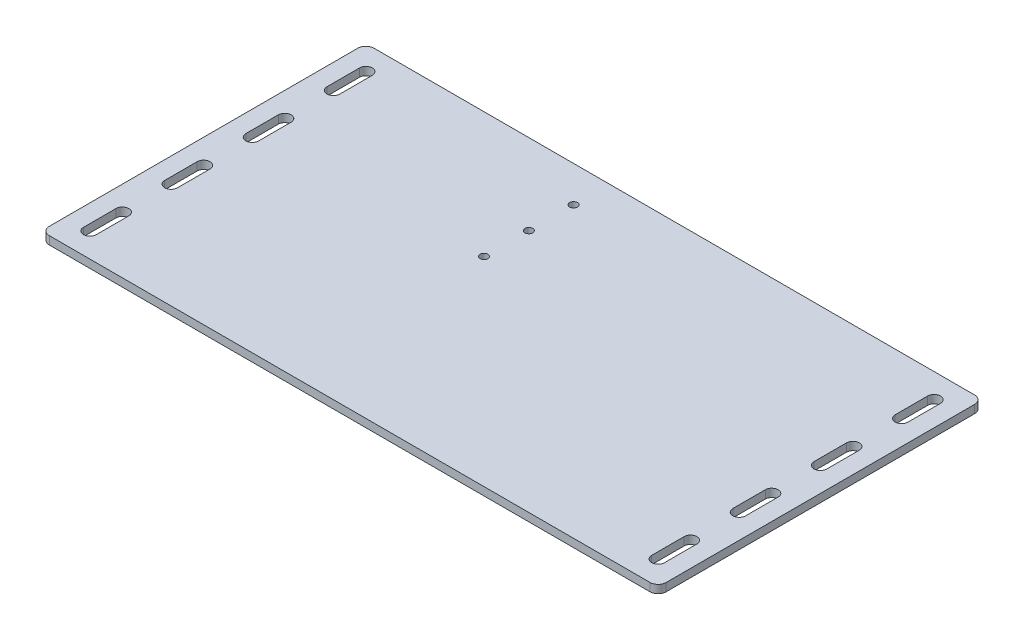
from build123d import *

# Parameters (mm, degrees)
SKETCH1_W           = 482.6
SKETCH1_H           = 254
BOSS_EXTRUDE1_DEPTH = 3.175
FILLET1_R           = 6.35
CUT_EXTRUDE1_REACH  = 274.754
SKETCH3_R           = 3.05
CUT_EXTRUDE2_DEPTH  = 273.754491255


with BuildPart() as part:
    # Sketch1 → Boss-Extrude1 (new, symmetric)
    with BuildSketch(Plane(origin=(0, 0, 0), x_dir=(1, 0, 0), z_dir=(0, 1, 0))):
        Rectangle(SKETCH1_W, SKETCH1_H)
    extrude(amount=BOSS_EXTRUDE1_DEPTH, both=True)

    # Fillet1
    fillet1_edges = [part.edges().sort_by_distance(p)[0] for p in [
        (241.3, 0, 127),
        (-241.3, 0, 127),
        (-241.3, 0, -127),
        (241.3, 0, -127),
    ]]
    fillet(fillet1_edges, radius=FILLET1_R)

    # Sketch2 → Cut-Extrude1 (cut, up to next)
    with BuildSketch(Plane(origin=(0, 3.175, 0), x_dir=(1, 0, 0), z_dir=(0, 1, 0)), mode=Mode.PRIVATE) as cut_extrude1_sk1:
        with BuildLine():
            Line((227.25, -82.55), (227.25, -107.95))
            ThreePointArc((227.25, -107.95), (222.25, -112.95), (217.25, -107.95))
            Line((217.25, -107.95), (217.25, -82.55))
            ThreePointArc((217.25, -82.55), (222.25, -77.55), (227.25, -82.55))
        make_face()
    cut_extrude1_tool1 = extrude(cut_extrude1_sk1.sketch, amount=-CUT_EXTRUDE1_REACH, mode=Mode.PRIVATE) & part.part
    # Sketch2 → Cut-Extrude1 (cut, up to next)
    with BuildSketch(Plane(origin=(0, 3.175, 0), x_dir=(1, 0, 0), z_dir=(0, 1, 0)), mode=Mode.PRIVATE) as cut_extrude1_sk2:
        with BuildLine():
            Line((227.25, -44.45), (227.25, -19.05))
            ThreePointArc((227.25, -19.05), (222.25, -14.05), (217.25, -19.05))
            Line((217.25, -19.05), (217.25, -44.45))
            ThreePointArc((217.25, -44.45), (222.25, -49.45), (227.25, -44.45))
        make_face()
    cut_extrude1_tool2 = extrude(cut_extrude1_sk2.sketch, amount=-CUT_EXTRUDE1_REACH, mode=Mode.PRIVATE) & part.part
    # Sketch2 → Cut-Extrude1 (cut, up to next)
    with BuildSketch(Plane(origin=(0, 3.175, 0), x_dir=(1, 0, 0), z_dir=(0, 1, 0)), mode=Mode.PRIVATE) as cut_extrude1_sk3:
        with BuildLine():
            Line((227.25, 44.45), (227.25, 19.05))
            ThreePointArc((227.25, 19.05), (222.25, 14.05), (217.25, 19.05))
            Line((217.25, 19.05), (217.25, 44.45))
            ThreePointArc((217.25, 44.45), (222.25, 49.45), (227.25, 44.45))
        make_face()
    cut_extrude1_tool3 = extrude(cut_extrude1_sk3.sketch, amount=-CUT_EXTRUDE1_REACH, mode=Mode.PRIVATE) & part.part
    # Sketch2 → Cut-Extrude1 (cut, up to next)
    with BuildSketch(Plane(origin=(0, 3.175, 0), x_dir=(1, 0, 0), z_dir=(0, 1, 0)), mode=Mode.PRIVATE) as cut_extrude1_sk4:
        with BuildLine():
            Line((227.25, 82.55), (227.25, 107.95))
            ThreePointArc((227.25, 107.95), (222.25, 112.95), (217.25, 107.95))
            Line((217.25, 107.95), (217.25, 82.55))
            ThreePointArc((217.25, 82.55), (222.25, 77.55), (227.25, 82.55))
        make_face()
    cut_extrude1_tool4 = extrude(cut_extrude1_sk4.sketch, amount=-CUT_EXTRUDE1_REACH, mode=Mode.PRIVATE) & part.part
    # Sketch2 → Cut-Extrude1 (cut, up to next)
    with BuildSketch(Plane(origin=(0, 3.175, 0), x_dir=(1, 0, 0), z_dir=(0, 1, 0)), mode=Mode.PRIVATE) as cut_extrude1_sk5:
        with BuildLine():
            Line((-227.25, 82.55), (-227.25, 107.95))
            ThreePointArc((-227.25, 107.95), (-222.25, 112.95), (-217.25, 107.95))
            Line((-217.25, 107.95), (-217.25, 82.55))
            ThreePointArc((-217.25, 82.55), (-222.25, 77.55), (-227.25, 82.55))
        make_face()
    cut_extrude1_tool5 = extrude(cut_extrude1_sk5.sketch, amount=-CUT_EXTRUDE1_REACH, mode=Mode.PRIVATE) & part.part
    # Sketch2 → Cut-Extrude1 (cut, up to next)
    with BuildSketch(Plane(origin=(0, 3.175, 0), x_dir=(1, 0, 0), z_dir=(0, 1, 0)), mode=Mode.PRIVATE) as cut_extrude1_sk6:
        with BuildLine():
            Line((-227.25, 44.45), (-227.25, 19.05))
            ThreePointArc((-227.25, 19.05), (-222.25, 14.05), (-217.25, 19.05))
            Line((-217.25, 19.05), (-217.25, 44.45))
            ThreePointArc((-217.25, 44.45), (-222.25, 49.45), (-227.25, 44.45))
        make_face()
    cut_extrude1_tool6 = extrude(cut_extrude1_sk6.sketch, amount=-CUT_EXTRUDE1_REACH, mode=Mode.PRIVATE) & part.part
    # Sketch2 → Cut-Extrude1 (cut, up to next)
    with BuildSketch(Plane(origin=(0, 3.175, 0), x_dir=(1, 0, 0), z_dir=(0, 1, 0)), mode=Mode.PRIVATE) as cut_extrude1_sk7:
        with BuildLine():
            Line((-227.25, -44.45), (-227.25, -19.05))
            ThreePointArc((-227.25, -19.05), (-222.25, -14.05), (-217.25, -19.05))
            Line((-217.25, -19.05), (-217.25, -44.45))
            ThreePointArc((-217.25, -44.45), (-222.25, -49.45), (-227.25, -44.45))
        make_face()
    cut_extrude1_tool7 = extrude(cut_extrude1_sk7.sketch, amount=-CUT_EXTRUDE1_REACH, mode=Mode.PRIVATE) & part.part
    # Sketch2 → Cut-Extrude1 (cut, up to next)
    with BuildSketch(Plane(origin=(0, 3.175, 0), x_dir=(1, 0, 0), z_dir=(0, 1, 0)), mode=Mode.PRIVATE) as cut_extrude1_sk8:
        with BuildLine():
            Line((-227.25, -82.55), (-227.25, -107.95))
            ThreePointArc((-227.25, -107.95), (-222.25, -112.95), (-217.25, -107.95))
            Line((-217.25, -107.95), (-217.25, -82.55))
            ThreePointArc((-217.25, -82.55), (-222.25, -77.55), (-227.25, -82.55))
        make_face()
    cut_extrude1_tool8 = extrude(cut_extrude1_sk8.sketch, amount=-CUT_EXTRUDE1_REACH, mode=Mode.PRIVATE) & part.part
    add(cut_extrude1_tool1.solids().sort_by_distance((222.25, 3.175, 95.25))[0], mode=Mode.SUBTRACT)
    add(cut_extrude1_tool2.solids().sort_by_distance((222.25, 3.175, 31.75))[0], mode=Mode.SUBTRACT)
    add(cut_extrude1_tool3.solids().sort_by_distance((222.25, 3.175, -31.75))[0], mode=Mode.SUBTRACT)
    add(cut_extrude1_tool4.solids().sort_by_distance((222.25, 3.175, -95.25))[0], mode=Mode.SUBTRACT)
    add(cut_extrude1_tool5.solids().sort_by_distance((-222.25, 3.175, -95.25))[0], mode=Mode.SUBTRACT)
    add(cut_extrude1_tool6.solids().sort_by_distance((-222.25, 3.175, -31.75))[0], mode=Mode.SUBTRACT)
    add(cut_extrude1_tool7.solids().sort_by_distance((-222.25, 3.175, 31.75))[0], mode=Mode.SUBTRACT)
    add(cut_extrude1_tool8.solids().sort_by_distance((-222.25, 3.175, 95.25))[0], mode=Mode.SUBTRACT)

    # Sketch3 → Cut-Extrude2 (cut, through all)
    with BuildSketch(Plane(origin=(0, 3.175, 0), x_dir=(1, 0, 0), z_dir=(0, 1, 0))):
        with Locations(Location((-50.8, 98.956, 0), (0, 0, 270))):
            Circle(SKETCH3_R)
        with Locations(Location((-50.8, 63.956, 0), (0, 0, 270))):
            Circle(SKETCH3_R)
        with Locations(Location((-50.8, 28.956, 0), (0, 0, 270))):
            Circle(SKETCH3_R)
    extrude(amount=-CUT_EXTRUDE2_DEPTH, mode=Mode.SUBTRACT)


solid = part.part
